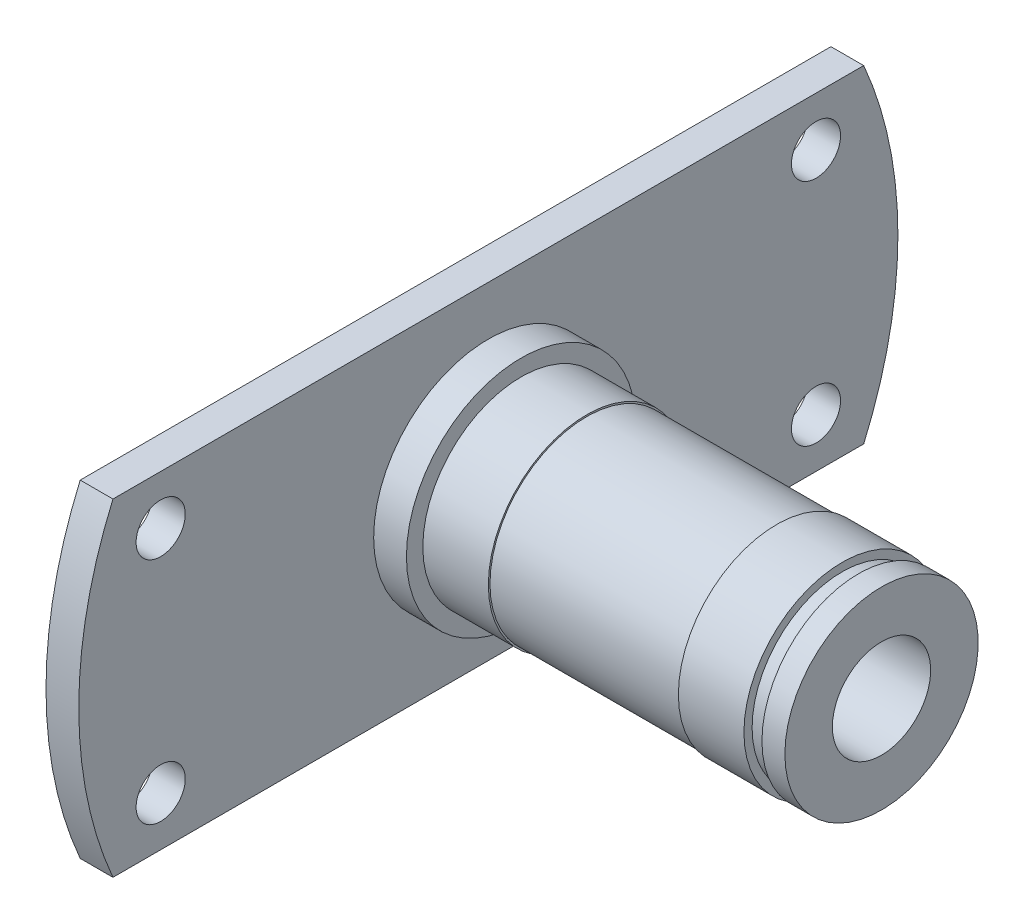
from build123d import *

# Parameters (mm, degrees)
SKETCH_2_R            = 25
SKETCH_2_R_2          = 1.5
EXTRUDE_1_DEPTH       = 2
CUT_EXTRUDE_2_REACH   = 44.732
SKETCH_5_W            = 45.82575695
SKETCH_5_H            = 15
HOLE_WIZARD_6_0_6_1_D = 6


with BuildPart() as part:
    # 草图1 → 旋转2 (revolve)
    with BuildSketch(Plane.XY, mode=Mode.PRIVATE) as revolve_2_sk:
        Polygon((4, 6), (0, 6), (0, 7), (-2, 7), (-2, 0), (22, 0), (22, 3), (22, 5.9), (20.6, 5.9), (20.6, 5.5), (19.6, 5.5), (19.6, 6), (15.6, 6), (15.6, 5.9), (4, 5.9), align=None)
    revolve(revolve_2_sk.sketch.rotate(Axis((-38.40520389, 0, 0), (1, 0, 0)), 90), axis=Axis((-38.40520389, 0, 0), (1, 0, 0)))

    # 草图2 → 凸台-拉伸1 (add)
    with BuildSketch(Plane.ZY.offset(2)):
        Circle(SKETCH_2_R)
        with Locations((-20, 7)):
            Circle(SKETCH_2_R_2, mode=Mode.SUBTRACT)
        with Locations(Location((20, 7, 0), (0, 0, 180))):
            Circle(SKETCH_2_R_2, mode=Mode.SUBTRACT)
        with Locations((20, -7)):
            Circle(SKETCH_2_R_2, mode=Mode.SUBTRACT)
        with Locations(Location((-20, -7, 0), (0, 0, 180))):
            Circle(SKETCH_2_R_2, mode=Mode.SUBTRACT)
    extrude(amount=EXTRUDE_1_DEPTH)

    # 草图5 → 切除-拉伸2 (cut, up to next)
    with BuildSketch(Plane(origin=(-2, 0, 0), x_dir=(0, 0, -1), z_dir=(1, 0, 0)), mode=Mode.PRIVATE) as cut_extrude_2_sk1:
        with Locations((0, 17.5)):
            Rectangle(SKETCH_5_W, SKETCH_5_H)
    cut_extrude_2_tool1 = extrude(cut_extrude_2_sk1.sketch, amount=-CUT_EXTRUDE_2_REACH, mode=Mode.PRIVATE) & part.part
    cut_extrude_2 = cut_extrude_2_tool1.solids().sort_by_distance((-2, 17.5, 0))[0]
    add(cut_extrude_2, mode=Mode.SUBTRACT)

    # 镜向1: 切除-拉伸2 across plane
    add(cut_extrude_2.mirror(Plane.ZX), mode=Mode.SUBTRACT)

    # Ø6.0 (6) 直径孔1 (through all)
    with Locations(Plane.ZY.offset(4)):
        with Locations((0, 0)):
            Hole(HOLE_WIZARD_6_0_6_1_D / 2)


solid = part.part
